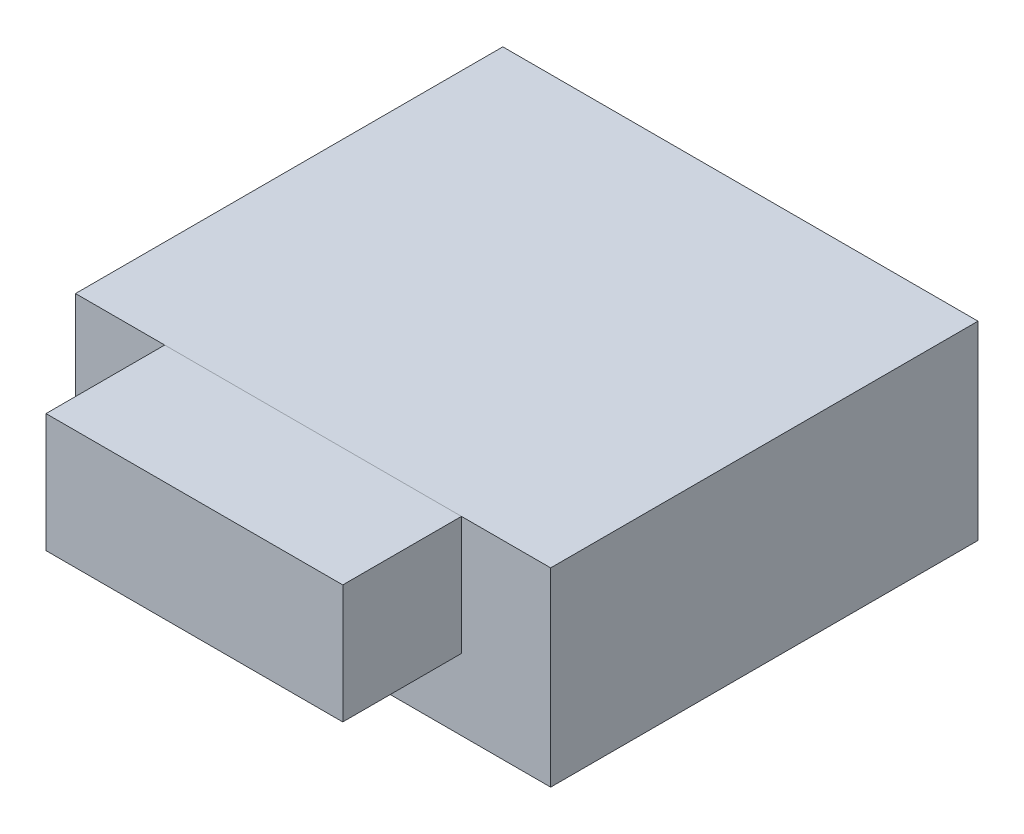
from build123d import *

# Parameters (mm, degrees)
SKETCH1_W           = 4.00295564
SKETCH1_H           = 3.6
BOSS_EXTRUDE1_DEPTH = 1.6
SKETCH2_W           = 2.5
SKETCH2_H           = 1
BOSS_EXTRUDE2_DEPTH = 1


with BuildPart() as part:
    # Sketch1 → Boss-Extrude1 (new body)
    with BuildSketch(Plane(origin=(0, 0, 0), x_dir=(1, 0, 0), z_dir=(0, 1, 0))):
        Rectangle(SKETCH1_W, SKETCH1_H)
    extrude(amount=BOSS_EXTRUDE1_DEPTH)


with BuildPart() as body_2:
    # Sketch2 → Boss-Extrude2 (new body)
    with BuildSketch(Plane.XY.offset(1.8)):
        with Locations((0, 1.1)):
            Rectangle(SKETCH2_W, SKETCH2_H)
    extrude(amount=BOSS_EXTRUDE2_DEPTH)


solid = Compound([part.part, body_2.part])
